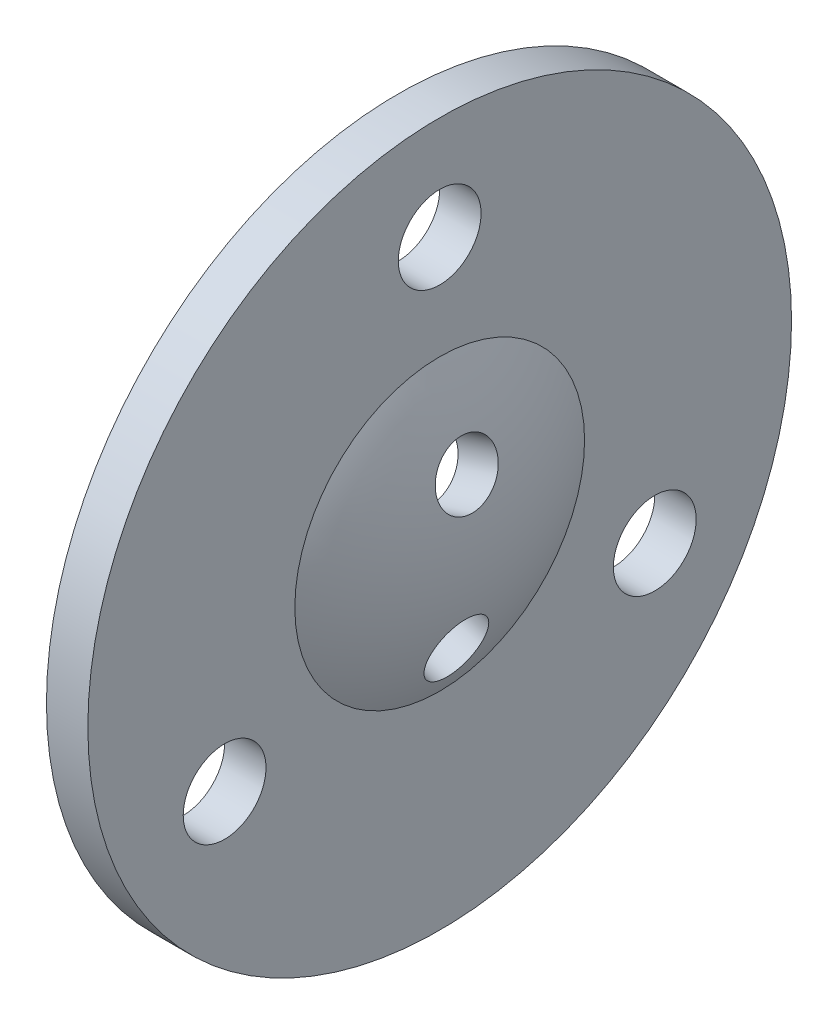
from build123d import *

# Parameters (mm, degrees)
SKETCH_2_R          = 2
CUT_EXTRUDE_1_DEPTH = 10
SKETCH_8_R          = 1.5
CUT_EXTRUDE_4_DEPTH = 10
SKETCH_9_R          = 1.5
CUT_EXTRUDE_5_DEPTH = 10


with BuildPart() as part:
    # 草图1 → 旋转1 (revolve)
    with BuildSketch(Plane.XY):
        with BuildLine():
            Line((14.38749457, 7), (14.38749457, 17))
            Line((14.38749457, 17), (12.38749457, 17))
            Line((12.38749457, 17), (12.38749457, 6.523034438))
            ThreePointArc((12.38749457, 6.523034438), (13.590896291, 3.359693142), (14, 0))
            Line((14, 0), (16, 0))
            ThreePointArc((16, 0), (15.591663047, 3.591663047), (14.38749457, 7))
        make_face()
    revolve(axis=Axis((0, 0, 0), (1, 0, 0)))

    # 草图2 → 切除-拉伸1 (cut)
    with BuildSketch(Plane.ZY.offset(-12.38749457)):
        with Locations((0, 12)):
            Circle(SKETCH_2_R)
        with Locations((10.392304845, -6)):
            Circle(SKETCH_2_R)
        with Locations((-10.392304845, -6)):
            Circle(SKETCH_2_R)
    extrude(amount=-CUT_EXTRUDE_1_DEPTH, mode=Mode.SUBTRACT)

    # 草图8 → 切除-拉伸4 (cut)
    with BuildSketch(Plane(origin=(18.259852425, 3.533095909, 0), x_dir=(0, 0, -1), z_dir=(0.9537169507482267, 0.30070579950427395, 0))):
        with Locations(Location((0, 0, 0), (0, 0, 90.000000005))):
            Circle(SKETCH_8_R)
    extrude(amount=-CUT_EXTRUDE_4_DEPTH, mode=Mode.SUBTRACT)

    # 草图9 → 切除-拉伸5 (cut)
    with BuildSketch(Plane(origin=(21.271029309, -4.482516334, 0), x_dir=(0, 0, -1), z_dir=(0.9537169507482268, -0.3007057995042737, 0))):
        with Locations(Location((0, -2.121270065, 0), (0, 0, 270))):
            Circle(SKETCH_9_R)
    extrude(amount=-CUT_EXTRUDE_5_DEPTH, mode=Mode.SUBTRACT)


solid = part.part
